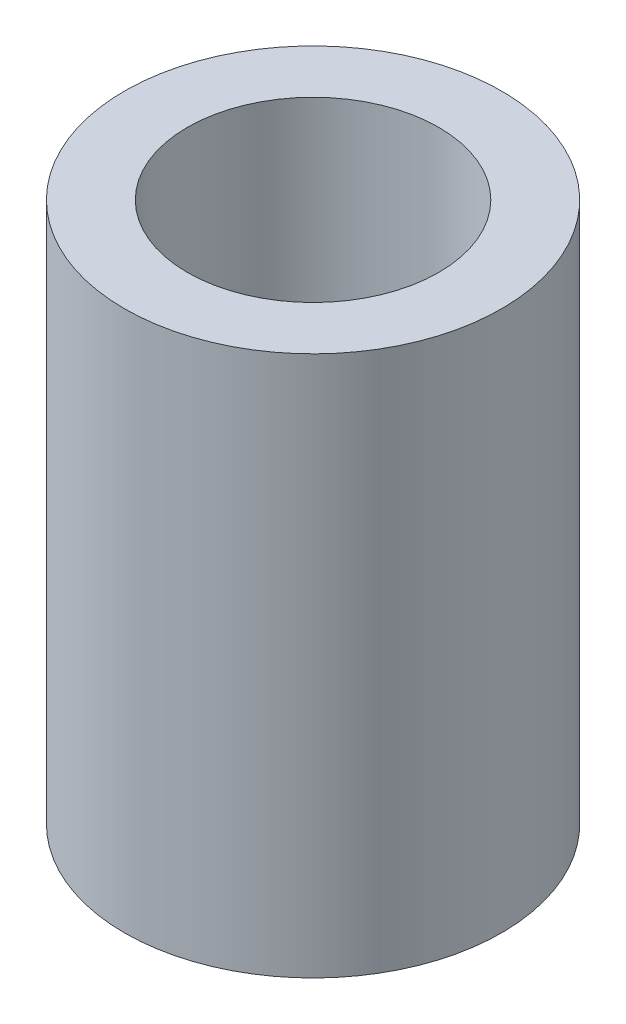
from build123d import *

# Parameters (mm, degrees)
SKETCH_1_R      = 7.5
SKETCH_1_R_2    = 5
EXTRUDE_1_DEPTH = 21.5


with BuildPart() as part:
    # 草图1 → 凸台-拉伸1 (new body)
    with BuildSketch(Plane(origin=(0, 0, 0), x_dir=(1, 0, 0), z_dir=(0, 1, 0))):
        with Locations(Location((0, 0, 0), (0, 0, 270))):
            Circle(SKETCH_1_R)
        with Locations(Location((0, 0, 0), (0, 0, 270))):
            Circle(SKETCH_1_R_2, mode=Mode.SUBTRACT)
    extrude(amount=EXTRUDE_1_DEPTH)


solid = part.part
